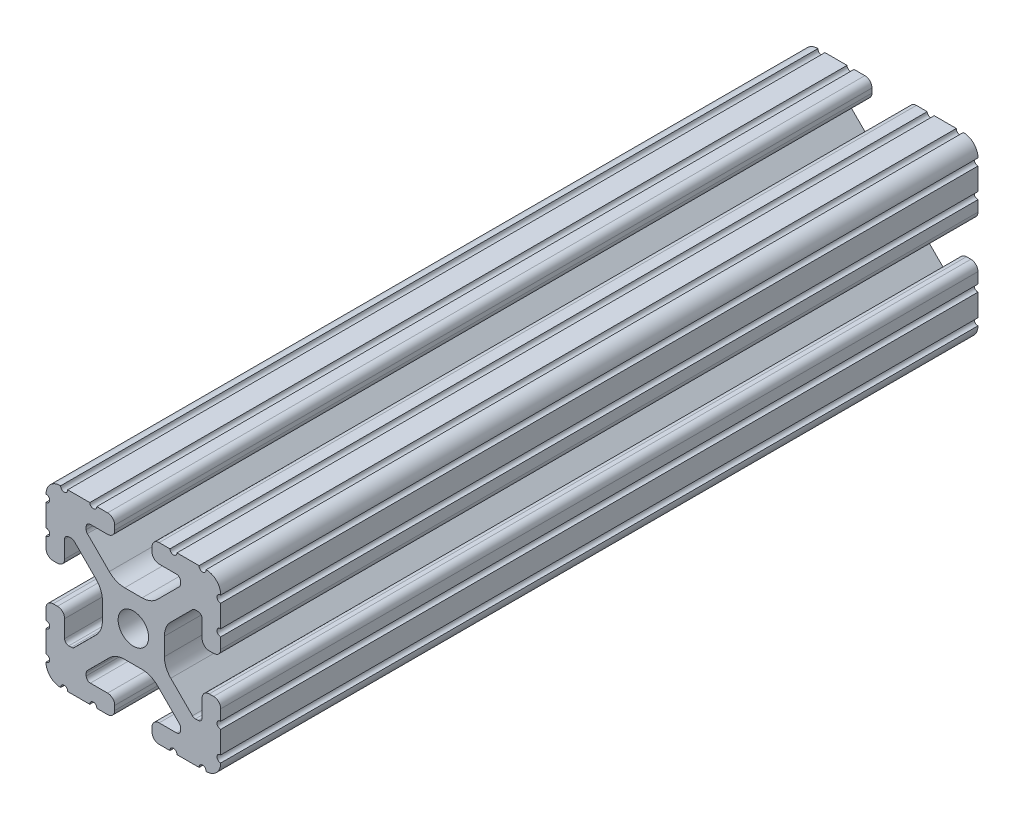
from build123d import *

# Parameters (mm, degrees)
SKETCH1_R      = 3.3274
EXTRUDE1_DEPTH = 165.1


with BuildPart() as part:
    # Sketch1 → Extrude1 (new body)
    with BuildSketch(Plane.XY):
        with BuildLine():
            Line((-10.022898969, 12.91475973), (-5.252158105, 8.144007132))
            ThreePointArc((-5.252158105, 8.144007132), (-3.715177372, 7.117027388), (-1.902183975, 6.7564))
            Line((-1.902183975, 6.7564), (1.902183975, 6.7564))
            ThreePointArc((1.902183975, 6.7564), (3.715177372, 7.117027388), (5.252158105, 8.144007132))
            Line((5.252158105, 8.144007132), (10.022898969, 12.91475973))
            ThreePointArc((10.022898969, 12.91475973), (10.218362387, 13.207291992), (10.287, 13.552357131))
            Line((10.287, 13.552357131), (10.287, 14.0843))
            ThreePointArc((10.287, 14.0843), (10.022898185, 14.721898185), (9.3853, 14.986))
            Line((9.3853, 14.986), (5.617617549, 14.986))
            ThreePointArc((5.617617549, 14.986), (4.519044045, 15.441044045), (4.064, 16.539617549))
            Line((4.064, 16.539617549), (4.064, 17.496382451))
            ThreePointArc((4.064, 17.496382451), (4.519044045, 18.594955955), (5.617617549, 19.05))
            Line((5.617617549, 19.05), (7.974178704, 19.05))
            ThreePointArc((7.974178704, 19.05), (8.736178704, 18.288), (9.498178704, 19.05))
            Line((9.498178704, 19.05), (14.327719207, 19.05))
            ThreePointArc((14.327719207, 19.05), (15.087603123, 18.231251131), (15.847487039, 19.05))
            ThreePointArc((15.847487039, 19.05), (18.120176289, 18.120192083), (19.05, 15.847509295))
            ThreePointArc((19.05, 15.847509295), (18.231250992, 15.08762539), (19.05, 14.327741484))
            Line((19.05, 14.327741484), (19.05, 9.496091471))
            ThreePointArc((19.05, 9.496091471), (18.231250992, 8.736207565), (19.05, 7.97632366))
            Line((19.05, 7.97632366), (19.05, 5.617617549))
            ThreePointArc((19.05, 5.617617549), (18.594955955, 4.519044045), (17.496382451, 4.064))
            Line((17.496382451, 4.064), (16.539617549, 4.064))
            ThreePointArc((16.539617549, 4.064), (15.441044045, 4.519044045), (14.986, 5.617617549))
            Line((14.986, 5.617617549), (14.986, 9.385342516))
            ThreePointArc((14.986, 9.385342516), (14.721898185, 10.022940701), (14.0843, 10.287042516))
            Line((14.0843, 10.287042516), (13.516042086, 10.287042516))
            ThreePointArc((13.516042086, 10.287042516), (13.170975923, 10.218404478), (12.878443117, 10.022939917))
            Line((12.878443117, 10.022939917), (8.14758008, 5.292065243))
            ThreePointArc((8.14758008, 5.292065243), (7.117955879, 3.751120653), (6.7564, 1.933453584))
            Line((6.7564, 1.933453584), (6.7564, -1.933453584))
            ThreePointArc((6.7564, -1.933453584), (7.117955879, -3.751120653), (8.14758008, -5.292065243))
            Line((8.14758008, -5.292065243), (12.878443117, -10.022939917))
            ThreePointArc((12.878443117, -10.022939917), (13.170975923, -10.218404478), (13.516042086, -10.287042516))
            Line((13.516042086, -10.287042516), (14.0843, -10.287042516))
            ThreePointArc((14.0843, -10.287042516), (14.721898185, -10.022940701), (14.986, -9.385342516))
            Line((14.986, -9.385342516), (14.986, -5.617617549))
            ThreePointArc((14.986, -5.617617549), (15.441044045, -4.519044045), (16.539617549, -4.064))
            Line((16.539617549, -4.064), (17.496382451, -4.064))
            ThreePointArc((17.496382451, -4.064), (18.594955955, -4.519044045), (19.05, -5.617617549))
            Line((19.05, -5.617617549), (19.05, -7.976318491))
            ThreePointArc((19.05, -7.976318491), (18.231250992, -8.736202396), (19.05, -9.496086302))
            Line((19.05, -9.496086302), (19.05, -14.32774291))
            ThreePointArc((19.05, -14.32774291), (18.231250992, -15.087626816), (19.05, -15.847510721))
            ThreePointArc((19.05, -15.847510721), (18.120175716, -18.120192644), (15.847486868, -19.05))
            ThreePointArc((15.847486868, -19.05), (15.087602952, -18.231251131), (14.327719036, -19.05))
            Line((14.327719036, -19.05), (9.496062448, -19.05))
            ThreePointArc((9.496062448, -19.05), (8.736178532, -18.231251131), (7.976294616, -19.05))
            Line((7.976294616, -19.05), (5.617617549, -19.05))
            ThreePointArc((5.617617549, -19.05), (4.519044045, -18.594955955), (4.064, -17.496382451))
            Line((4.064, -17.496382451), (4.064, -16.539617549))
            ThreePointArc((4.064, -16.539617549), (4.519044045, -15.441044045), (5.617617549, -14.986))
            Line((5.617617549, -14.986), (9.3853, -14.986))
            ThreePointArc((9.3853, -14.986), (10.022898185, -14.721898185), (10.287, -14.0843))
            Line((10.287, -14.0843), (10.287, -13.552357131))
            ThreePointArc((10.287, -13.552357131), (10.218362387, -13.207291992), (10.022898969, -12.91475973))
            Line((10.022898969, -12.91475973), (5.252158105, -8.144007132))
            ThreePointArc((5.252158105, -8.144007132), (3.715177372, -7.117027388), (1.902183975, -6.7564))
            Line((1.902183975, -6.7564), (-1.902183975, -6.7564))
            ThreePointArc((-1.902183975, -6.7564), (-3.715177372, -7.117027388), (-5.252158105, -8.144007132))
            Line((-5.252158105, -8.144007132), (-10.022898969, -12.91475973))
            ThreePointArc((-10.022898969, -12.91475973), (-10.218362387, -13.207291992), (-10.287, -13.552357131))
            Line((-10.287, -13.552357131), (-10.287, -14.0843))
            ThreePointArc((-10.287, -14.0843), (-10.022898185, -14.721898185), (-9.3853, -14.986))
            Line((-9.3853, -14.986), (-5.617617549, -14.986))
            ThreePointArc((-5.617617549, -14.986), (-4.519044045, -15.441044045), (-4.064, -16.539617549))
            Line((-4.064, -16.539617549), (-4.064, -17.496382451))
            ThreePointArc((-4.064, -17.496382451), (-4.519044045, -18.594955955), (-5.617617549, -19.05))
            Line((-5.617617549, -19.05), (-7.976294616, -19.05))
            ThreePointArc((-7.976294616, -19.05), (-8.736178532, -18.231251131), (-9.496062448, -19.05))
            Line((-9.496062448, -19.05), (-14.327719036, -19.05))
            ThreePointArc((-14.327719036, -19.05), (-15.087602952, -18.231251131), (-15.847486868, -19.05))
            ThreePointArc((-15.847486868, -19.05), (-18.120175716, -18.120192644), (-19.05, -15.847510721))
            ThreePointArc((-19.05, -15.847510721), (-18.231250992, -15.087626816), (-19.05, -14.32774291))
            Line((-19.05, -14.32774291), (-19.05, -9.496086302))
            ThreePointArc((-19.05, -9.496086302), (-18.231250992, -8.736202396), (-19.05, -7.976318491))
            Line((-19.05, -7.976318491), (-19.05, -5.617617549))
            ThreePointArc((-19.05, -5.617617549), (-18.594955955, -4.519044045), (-17.496382451, -4.064))
            Line((-17.496382451, -4.064), (-16.539617549, -4.064))
            ThreePointArc((-16.539617549, -4.064), (-15.441044045, -4.519044045), (-14.986, -5.617617549))
            Line((-14.986, -5.617617549), (-14.986, -9.385342516))
            ThreePointArc((-14.986, -9.385342516), (-14.721898185, -10.022940701), (-14.0843, -10.287042516))
            Line((-14.0843, -10.287042516), (-13.516042086, -10.287042516))
            ThreePointArc((-13.516042086, -10.287042516), (-13.170975923, -10.218404478), (-12.878443117, -10.022939917))
            Line((-12.878443117, -10.022939917), (-8.14758008, -5.292065243))
            ThreePointArc((-8.14758008, -5.292065243), (-7.117955879, -3.751120653), (-6.7564, -1.933453584))
            Line((-6.7564, -1.933453584), (-6.7564, 1.933453584))
            ThreePointArc((-6.7564, 1.933453584), (-7.117955879, 3.751120653), (-8.14758008, 5.292065243))
            Line((-8.14758008, 5.292065243), (-12.878443117, 10.022939917))
            ThreePointArc((-12.878443117, 10.022939917), (-13.170975923, 10.218404478), (-13.516042086, 10.287042516))
            Line((-13.516042086, 10.287042516), (-14.0843, 10.287042516))
            ThreePointArc((-14.0843, 10.287042516), (-14.721898185, 10.022940701), (-14.986, 9.385342516))
            Line((-14.986, 9.385342516), (-14.986, 5.617617549))
            ThreePointArc((-14.986, 5.617617549), (-15.441044045, 4.519044045), (-16.539617549, 4.064))
            Line((-16.539617549, 4.064), (-17.496382451, 4.064))
            ThreePointArc((-17.496382451, 4.064), (-18.594955955, 4.519044045), (-19.05, 5.617617549))
            Line((-19.05, 5.617617549), (-19.05, 7.97632366))
            ThreePointArc((-19.05, 7.97632366), (-18.231250992, 8.736207565), (-19.05, 9.496091471))
            Line((-19.05, 9.496091471), (-19.05, 14.327741484))
            ThreePointArc((-19.05, 14.327741484), (-18.231250992, 15.08762539), (-19.05, 15.847509295))
            ThreePointArc((-19.05, 15.847509295), (-18.120176289, 18.120192083), (-15.847487039, 19.05))
            ThreePointArc((-15.847487039, 19.05), (-15.087603123, 18.231251131), (-14.327719207, 19.05))
            Line((-14.327719207, 19.05), (-9.498178704, 19.05))
            ThreePointArc((-9.498178704, 19.05), (-8.736178704, 18.288), (-7.974178704, 19.05))
            Line((-7.974178704, 19.05), (-5.617617549, 19.05))
            ThreePointArc((-5.617617549, 19.05), (-4.519044045, 18.594955955), (-4.064, 17.496382451))
            Line((-4.064, 17.496382451), (-4.064, 16.539617549))
            ThreePointArc((-4.064, 16.539617549), (-4.519044045, 15.441044045), (-5.617617549, 14.986))
            Line((-5.617617549, 14.986), (-9.3853, 14.986))
            ThreePointArc((-9.3853, 14.986), (-10.022898185, 14.721898185), (-10.287, 14.0843))
            Line((-10.287, 14.0843), (-10.287, 13.552357131))
            ThreePointArc((-10.287, 13.552357131), (-10.218362387, 13.207291992), (-10.022898969, 12.91475973))
        make_face()
        Circle(SKETCH1_R, mode=Mode.SUBTRACT)
    extrude(amount=-EXTRUDE1_DEPTH)


solid = part.part
